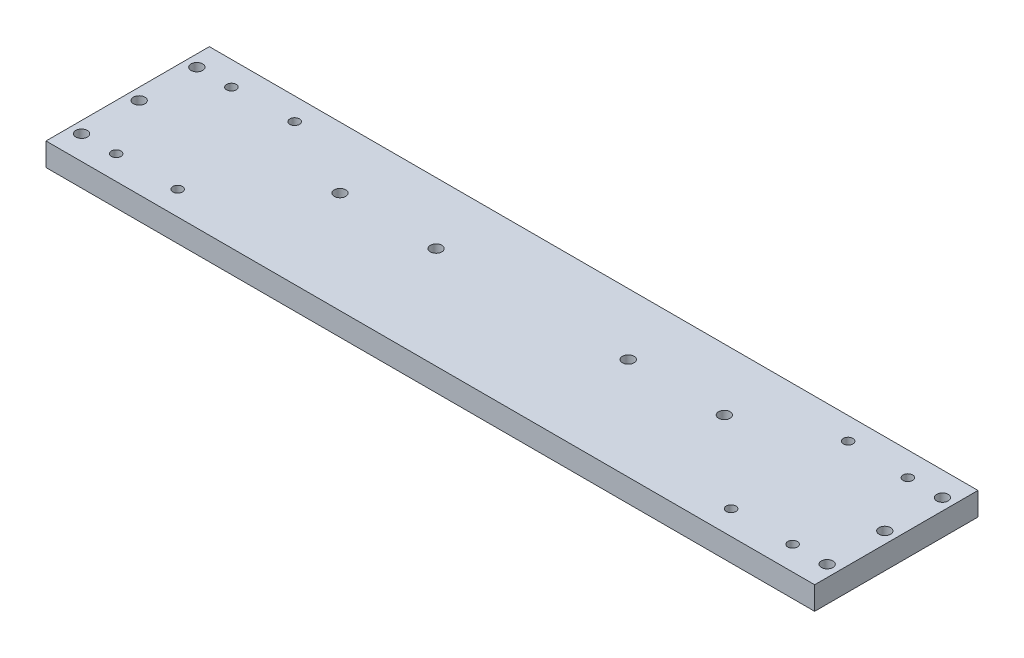
from build123d import *

# Parameters (mm, degrees)
SKETCH1_W           = 400
SKETCH1_H           = 85
BOSS_EXTRUDE1_DEPTH = 12
CUT_EXTRUDE1_REACH  = 206.818
SKETCH2_R           = 2.5
CUT_EXTRUDE2_REACH  = 206.818
SKETCH3_R           = 3
CUT_EXTRUDE3_REACH  = 206.818
SKETCH4_R           = 3


with BuildPart() as part:
    # Sketch1 → Boss-Extrude1 (new body)
    with BuildSketch(Plane(origin=(0, 0, 0), x_dir=(1, 0, 0), z_dir=(0, 1, 0))):
        Rectangle(SKETCH1_W, SKETCH1_H)
    extrude(amount=BOSS_EXTRUDE1_DEPTH)

    # Sketch2 → Cut-Extrude1 (cut, up to next)
    with BuildSketch(Plane(origin=(0, 12, 0), x_dir=(1, 0, 0), z_dir=(0, 1, 0)), mode=Mode.PRIVATE) as cut_extrude1_sk1:
        with Locations(Location((-176, -30, 0), (0, 0, 270))):
            Circle(SKETCH2_R)
    cut_extrude1_tool1 = extrude(cut_extrude1_sk1.sketch, amount=-CUT_EXTRUDE1_REACH, mode=Mode.PRIVATE) & part.part
    # Sketch2 → Cut-Extrude1 (cut, up to next)
    with BuildSketch(Plane(origin=(0, 12, 0), x_dir=(1, 0, 0), z_dir=(0, 1, 0)), mode=Mode.PRIVATE) as cut_extrude1_sk2:
        with Locations(Location((-144, -30, 0), (0, 0, 270))):
            Circle(SKETCH2_R)
    cut_extrude1_tool2 = extrude(cut_extrude1_sk2.sketch, amount=-CUT_EXTRUDE1_REACH, mode=Mode.PRIVATE) & part.part
    # Sketch2 → Cut-Extrude1 (cut, up to next)
    with BuildSketch(Plane(origin=(0, 12, 0), x_dir=(1, 0, 0), z_dir=(0, 1, 0)), mode=Mode.PRIVATE) as cut_extrude1_sk3:
        with Locations(Location((-144, 30.918491962, 0), (0, 0, 270))):
            Circle(SKETCH2_R)
    cut_extrude1_tool3 = extrude(cut_extrude1_sk3.sketch, amount=-CUT_EXTRUDE1_REACH, mode=Mode.PRIVATE) & part.part
    # Sketch2 → Cut-Extrude1 (cut, up to next)
    with BuildSketch(Plane(origin=(0, 12, 0), x_dir=(1, 0, 0), z_dir=(0, 1, 0)), mode=Mode.PRIVATE) as cut_extrude1_sk4:
        with Locations(Location((-176, 30, 0), (0, 0, 270))):
            Circle(SKETCH2_R)
    cut_extrude1_tool4 = extrude(cut_extrude1_sk4.sketch, amount=-CUT_EXTRUDE1_REACH, mode=Mode.PRIVATE) & part.part
    cut_extrude1_1 = cut_extrude1_tool1.solids().sort_by_distance((-176, 12, 30))[0]
    add(cut_extrude1_1, mode=Mode.SUBTRACT)
    cut_extrude1_2 = cut_extrude1_tool2.solids().sort_by_distance((-144, 12, 30))[0]
    add(cut_extrude1_2, mode=Mode.SUBTRACT)
    cut_extrude1_3 = cut_extrude1_tool3.solids().sort_by_distance((-144, 12, -30.918492))[0]
    add(cut_extrude1_3, mode=Mode.SUBTRACT)
    cut_extrude1_4 = cut_extrude1_tool4.solids().sort_by_distance((-176, 12, -30))[0]
    add(cut_extrude1_4, mode=Mode.SUBTRACT)
    cut_extrude1 = cut_extrude1_1 + cut_extrude1_2 + cut_extrude1_3 + cut_extrude1_4  # Cut-Extrude1 as one shape, for the pattern or mirror that repeats it

    # Mirror1: Cut-Extrude1 across plane
    add(cut_extrude1.mirror(Plane(origin=(0, 0, 0), x_dir=(0, 0, 1), z_dir=(1, 0, 0))), mode=Mode.SUBTRACT)

    # Sketch3 → Cut-Extrude2 (cut, up to next)
    with BuildSketch(Plane(origin=(0, 12, 0), x_dir=(1, 0, 0), z_dir=(0, 1, 0)), mode=Mode.PRIVATE) as cut_extrude2_sk1:
        with Locations(Location((50, 10.5, 0), (0, 0, 270))):
            Circle(SKETCH3_R)
    cut_extrude2_tool1 = extrude(cut_extrude2_sk1.sketch, amount=-CUT_EXTRUDE2_REACH, mode=Mode.PRIVATE) & part.part
    # Sketch3 → Cut-Extrude2 (cut, up to next)
    with BuildSketch(Plane(origin=(0, 12, 0), x_dir=(1, 0, 0), z_dir=(0, 1, 0)), mode=Mode.PRIVATE) as cut_extrude2_sk2:
        with Locations(Location((100, 10.5, 0), (0, 0, 270))):
            Circle(SKETCH3_R)
    cut_extrude2_tool2 = extrude(cut_extrude2_sk2.sketch, amount=-CUT_EXTRUDE2_REACH, mode=Mode.PRIVATE) & part.part
    # Sketch3 → Cut-Extrude2 (cut, up to next)
    with BuildSketch(Plane(origin=(0, 12, 0), x_dir=(1, 0, 0), z_dir=(0, 1, 0)), mode=Mode.PRIVATE) as cut_extrude2_sk3:
        with Locations(Location((-100, 10.5, 0), (0, 0, 270))):
            Circle(SKETCH3_R)
    cut_extrude2_tool3 = extrude(cut_extrude2_sk3.sketch, amount=-CUT_EXTRUDE2_REACH, mode=Mode.PRIVATE) & part.part
    # Sketch3 → Cut-Extrude2 (cut, up to next)
    with BuildSketch(Plane(origin=(0, 12, 0), x_dir=(1, 0, 0), z_dir=(0, 1, 0)), mode=Mode.PRIVATE) as cut_extrude2_sk4:
        with Locations(Location((-50, 10.5, 0), (0, 0, 270))):
            Circle(SKETCH3_R)
    cut_extrude2_tool4 = extrude(cut_extrude2_sk4.sketch, amount=-CUT_EXTRUDE2_REACH, mode=Mode.PRIVATE) & part.part
    add(cut_extrude2_tool1.solids().sort_by_distance((50, 12, -10.5))[0], mode=Mode.SUBTRACT)
    add(cut_extrude2_tool2.solids().sort_by_distance((100, 12, -10.5))[0], mode=Mode.SUBTRACT)
    add(cut_extrude2_tool3.solids().sort_by_distance((-100, 12, -10.5))[0], mode=Mode.SUBTRACT)
    add(cut_extrude2_tool4.solids().sort_by_distance((-50, 12, -10.5))[0], mode=Mode.SUBTRACT)

    # Sketch4 → Cut-Extrude3 (cut, up to next)
    with BuildSketch(Plane(origin=(0, 12, 0), x_dir=(1, 0, 0), z_dir=(0, 1, 0)), mode=Mode.PRIVATE) as cut_extrude3_sk1:
        with Locations(Location((-194, 0, 0), (0, 0, 270))):
            Circle(SKETCH4_R)
    cut_extrude3_tool1 = extrude(cut_extrude3_sk1.sketch, amount=-CUT_EXTRUDE3_REACH, mode=Mode.PRIVATE) & part.part
    # Sketch4 → Cut-Extrude3 (cut, up to next)
    with BuildSketch(Plane(origin=(0, 12, 0), x_dir=(1, 0, 0), z_dir=(0, 1, 0)), mode=Mode.PRIVATE) as cut_extrude3_sk2:
        with Locations(Location((-194, 30, 0), (0, 0, 270))):
            Circle(SKETCH4_R)
    cut_extrude3_tool2 = extrude(cut_extrude3_sk2.sketch, amount=-CUT_EXTRUDE3_REACH, mode=Mode.PRIVATE) & part.part
    # Sketch4 → Cut-Extrude3 (cut, up to next)
    with BuildSketch(Plane(origin=(0, 12, 0), x_dir=(1, 0, 0), z_dir=(0, 1, 0)), mode=Mode.PRIVATE) as cut_extrude3_sk3:
        with Locations(Location((-194, -30, 0), (0, 0, 270))):
            Circle(SKETCH4_R)
    cut_extrude3_tool3 = extrude(cut_extrude3_sk3.sketch, amount=-CUT_EXTRUDE3_REACH, mode=Mode.PRIVATE) & part.part
    cut_extrude3_1 = cut_extrude3_tool1.solids().sort_by_distance((-194, 12, 0))[0]
    add(cut_extrude3_1, mode=Mode.SUBTRACT)
    cut_extrude3_2 = cut_extrude3_tool2.solids().sort_by_distance((-194, 12, -30))[0]
    add(cut_extrude3_2, mode=Mode.SUBTRACT)
    cut_extrude3_3 = cut_extrude3_tool3.solids().sort_by_distance((-194, 12, 30))[0]
    add(cut_extrude3_3, mode=Mode.SUBTRACT)
    cut_extrude3 = cut_extrude3_1 + cut_extrude3_2 + cut_extrude3_3  # Cut-Extrude3 as one shape, for the pattern or mirror that repeats it

    # Mirror2: Cut-Extrude3 across plane
    add(cut_extrude3.mirror(Plane(origin=(0, 0, 0), x_dir=(0, 0, 1), z_dir=(1, 0, 0))), mode=Mode.SUBTRACT)


solid = part.part
